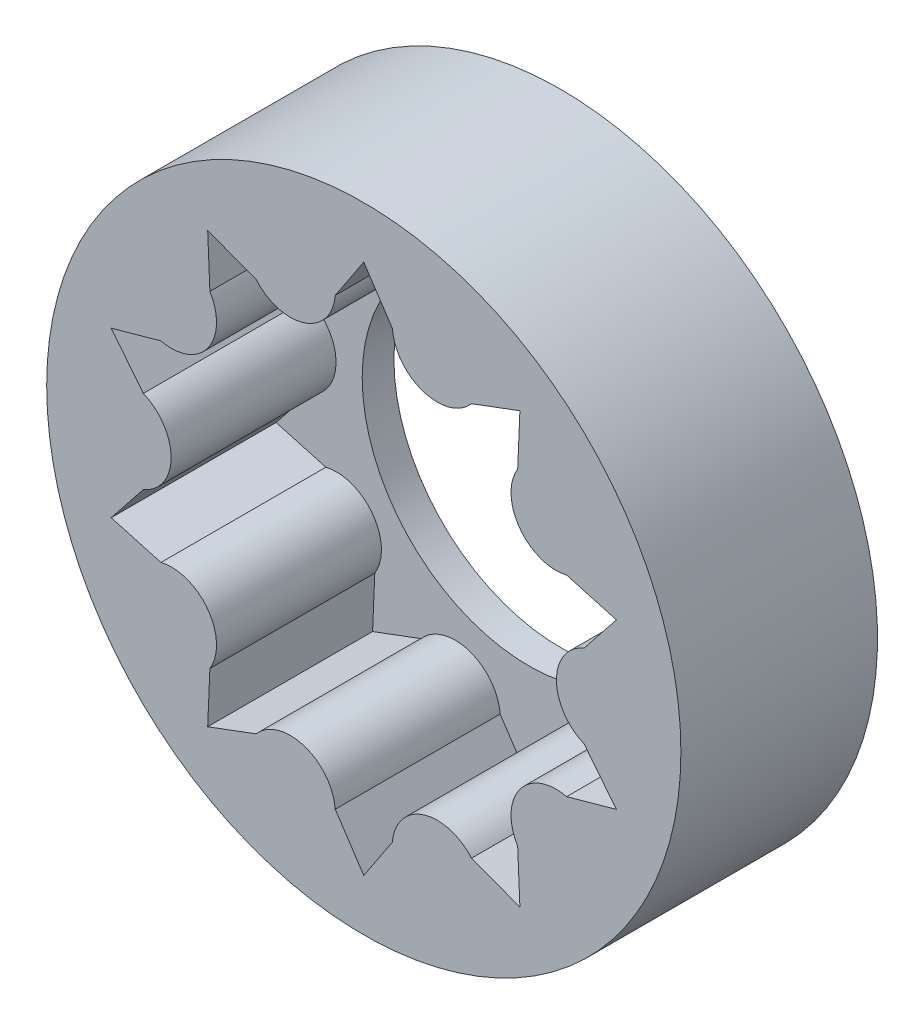
from build123d import *

# Parameters (mm, degrees)
BOSS_EXTRUDE1_DEPTH = 10.4
CIRPATTERN1_COUNT   = 10
BOSS_EXTRUDE2_START = 2
SKETCH2_R           = 20
SKETCH2_R_2         = 10.5
BOSS_EXTRUDE2_DEPTH = 2


with BuildPart() as part:
    # Sketch1 → Boss-Extrude1 (new body)
    with BuildSketch(Plane.XY):
        with BuildLine():
            Line((6.793214092, 12.412684734), (9.845402976, 13.551034656))
            Line((9.845402976, 13.551034656), (11.755705046, 16.180339887))
            ThreePointArc((11.755705046, 16.180339887), (6.180339887, 19.021130326), (0, 20))
            Line((0, 20), (0, 16.75))
            Line((0, 16.75), (1.800167381, 14.035023954))
            ThreePointArc((1.800167381, 14.035023954), (3.754556482, 11.555336673), (6.793214092, 12.412684734))
        make_face()
    boss_extrude1 = extrude(amount=BOSS_EXTRUDE1_DEPTH)

    # CirPattern1: Boss-Extrude1 ×10 about axis
    cirpattern1_axis = Axis((0, 0, -0.52), (0, 0, 1))
    for i in range(1, CIRPATTERN1_COUNT):
        add(boss_extrude1.rotate(cirpattern1_axis, i * 360 / CIRPATTERN1_COUNT))

    # Sketch2 → Boss-Extrude2 (add)
    with BuildSketch(Plane(origin=(0, 0, 0), x_dir=(-1, 0, 0), z_dir=(0, 0, -1)).offset(BOSS_EXTRUDE2_START)):
        Circle(SKETCH2_R)
        Circle(SKETCH2_R_2, mode=Mode.SUBTRACT)
    extrude(amount=-BOSS_EXTRUDE2_DEPTH)


solid = part.part
